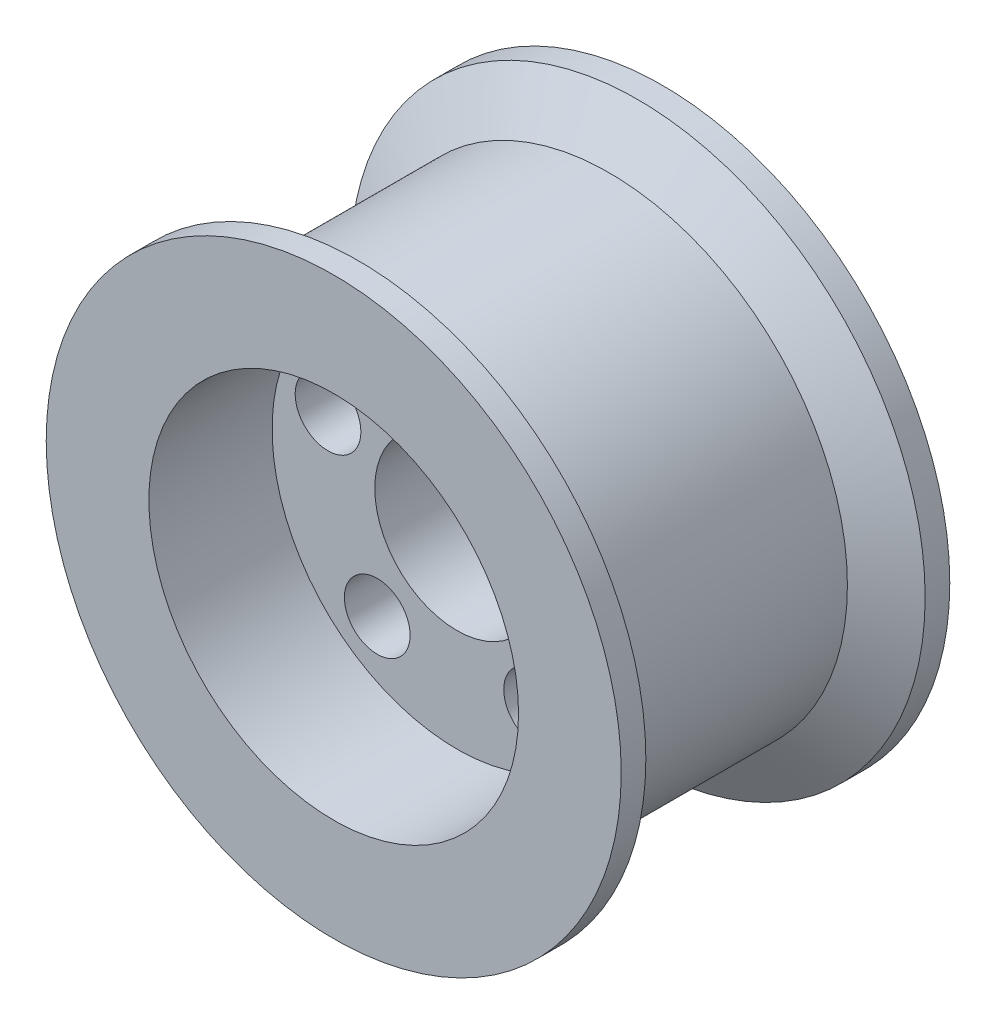
from build123d import *

# Parameters (mm, degrees)
ESQUISSE1_R                  = 35
ESQUISSE1_R_2                = 10
BOSS_EXTRU_1_DEPTH           = 20
ESQUISSE2_R                  = 22.5
ENL_V_MAT_EXTRU_1_DEPTH      = 15
ESQUISSE3_R                  = 4
ENL_V_MAT_EXTRU_2_DEPTH      = 56.452682532
R_P_TITION_CIRCULAIRE1_COUNT = 5


with BuildPart() as part:
    # Esquisse1 → Boss.-Extru.1 (new, symmetric)
    with BuildSketch(Plane.XY):
        Circle(ESQUISSE1_R)
        Circle(ESQUISSE1_R_2, mode=Mode.SUBTRACT)
    extrude(amount=BOSS_EXTRU_1_DEPTH, both=True)

    # Esquisse2 → Enlèv. mat.-Extru.1 (cut)
    with BuildSketch(Plane.XY.offset(20)):
        Circle(ESQUISSE2_R)
    enl_v_mat_extru_1 = extrude(amount=-ENL_V_MAT_EXTRU_1_DEPTH, mode=Mode.SUBTRACT)

    # Symétrie1: Enlèv. mat.-Extru.1 across plane
    add(enl_v_mat_extru_1.mirror(Plane.XY), mode=Mode.SUBTRACT)

    # Esquisse3 → Enlèv. mat.-Extru.2 (cut, through all)
    with BuildSketch(Plane.XY.offset(5)):
        with Locations((0, 16.5)):
            Circle(ESQUISSE3_R)
    enl_v_mat_extru_2 = extrude(amount=-ENL_V_MAT_EXTRU_2_DEPTH, mode=Mode.SUBTRACT)

    # Répétition circulaire1: Enlèv. mat.-Extru.2 ×5 about axis
    r_p_tition_circulaire1_axis = Axis((0, 0, 0), (0, 0, 1))
    for i in range(1, R_P_TITION_CIRCULAIRE1_COUNT):
        add(enl_v_mat_extru_2.rotate(r_p_tition_circulaire1_axis, i * 360 / R_P_TITION_CIRCULAIRE1_COUNT), mode=Mode.SUBTRACT)

    # Esquisse4 → Enlèvement de matière-Révolution1 (revolve, cut)
    with BuildSketch(Plane(origin=(0, 0, 0), x_dir=(1, 0, 0), z_dir=(0, 1, 0)), mode=Mode.PRIVATE) as enl_vement_de_mati_re_r_volution1_sk:
        Polygon((35, 17), (29, 13.535898385), (29, -13.535898385), (35, -17), align=None)
    revolve(enl_vement_de_mati_re_r_volution1_sk.sketch.rotate(Axis((0, 0, -37.926889672), (0, 0, 1)), 180), axis=Axis((0, 0, -37.926889672), (0, 0, 1)), mode=Mode.SUBTRACT)


solid = part.part
